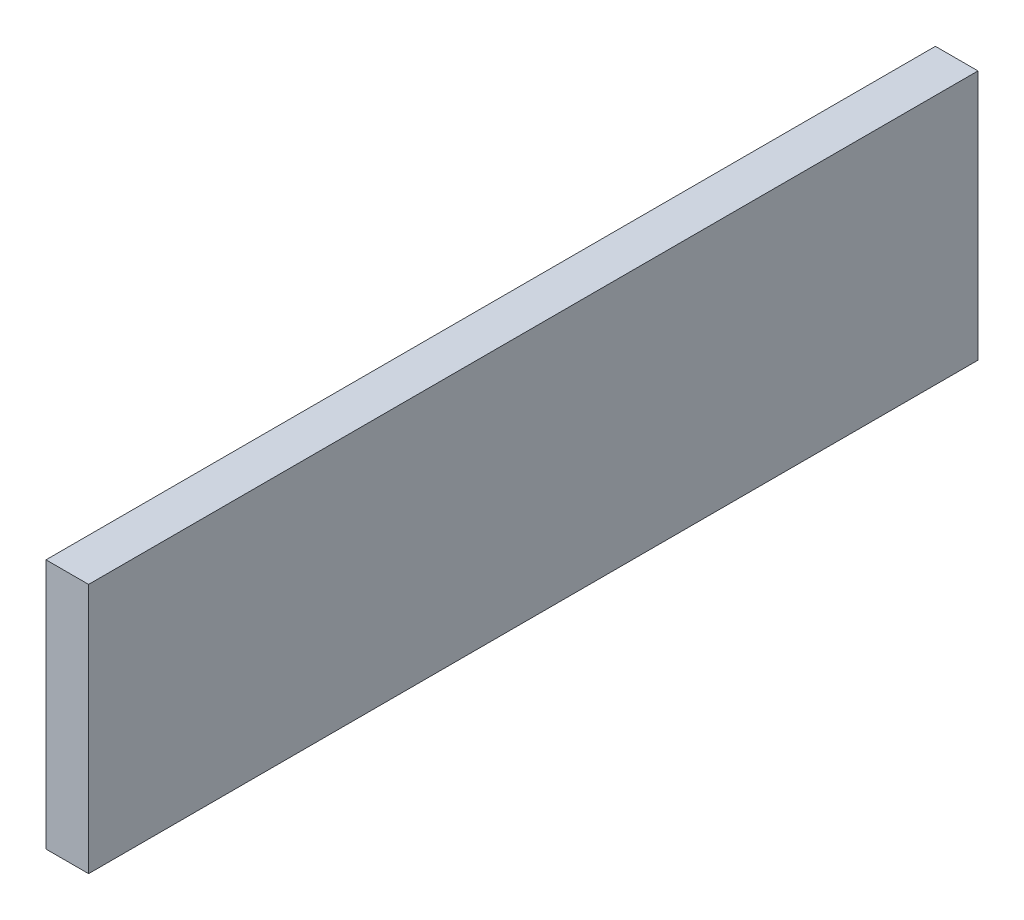
from build123d import *

# Parameters (mm, degrees)
SKETCH1_W           = 1.7
SKETCH1_H           = 35.5
BOSS_EXTRUDE1_DEPTH = 10


with BuildPart() as part:
    # Sketch1 → Boss-Extrude1 (new body)
    with BuildSketch(Plane(origin=(0, 0, 0), x_dir=(1, 0, 0), z_dir=(0, 1, 0))):
        with Locations((0.85, -17.75)):
            Rectangle(SKETCH1_W, SKETCH1_H)
    extrude(amount=BOSS_EXTRUDE1_DEPTH)


solid = part.part
